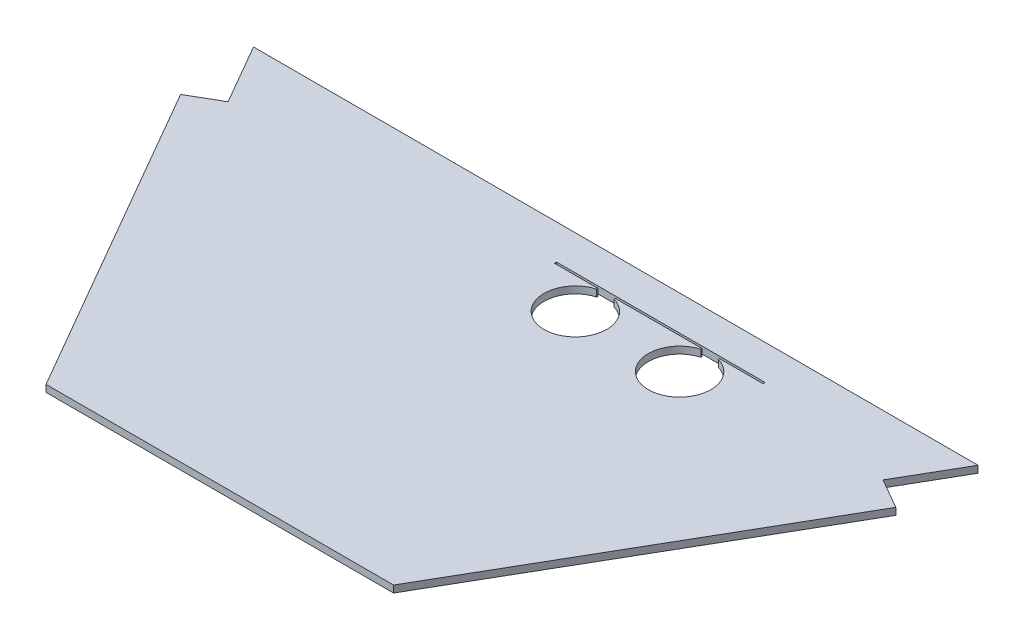
from build123d import *

# Parameters (mm, degrees)
BOSS_EXTRUDE1_DEPTH = 10
CUT_EXTRUDE6_DEPTH  = 10


with BuildPart() as part:
    # Sketch1 → Boss-Extrude1 (new body)
    with BuildSketch(Plane(origin=(0, 0, 0), x_dir=(1, 0, 0), z_dir=(0, 1, 0))):
        Polygon((-271.133729811, 569.617395678), (771.133729811, 569.617395678), (721.133729811, 483.014855299), (764.435, 458.014855299), (500, 0), (0, 0), (-264.435, 458.014855299), (-221.133729811, 483.014855299), align=None)
    extrude(amount=BOSS_EXTRUDE1_DEPTH)

    # Sketch2 → Cut-Extrude6 (cut)
    with BuildSketch(Plane(origin=(0, 0, 0), x_dir=(-1, 0, 0), z_dir=(0, -1, 0))):
        with BuildLine():
            Line((-514.883729811, 519.62), (-514.883729811, 516.62))
            Line((-514.883729811, 516.62), (-452.38, 516.62))
            Line((-452.38, 516.62), (-452.38, 514.849041164))
            ThreePointArc((-452.38, 514.849041164), (-439.88, 426.62), (-427.38, 514.849041164))
            Line((-427.38, 514.849041164), (-427.38, 516.62))
            Line((-427.38, 516.62), (-302.38, 516.62))
            Line((-302.38, 516.62), (-302.38, 514.849041164))
            ThreePointArc((-302.38, 514.849041164), (-289.88, 426.62), (-277.38, 514.849041164))
            Line((-277.38, 514.849041164), (-277.38, 516.62))
            Line((-277.38, 516.62), (-214.883729811, 516.62))
            Line((-214.883729811, 516.62), (-214.883729811, 519.62))
            Line((-214.883729811, 519.62), (-514.883729811, 519.62))
        make_face()
    extrude(amount=-CUT_EXTRUDE6_DEPTH, mode=Mode.SUBTRACT)


solid = part.part
